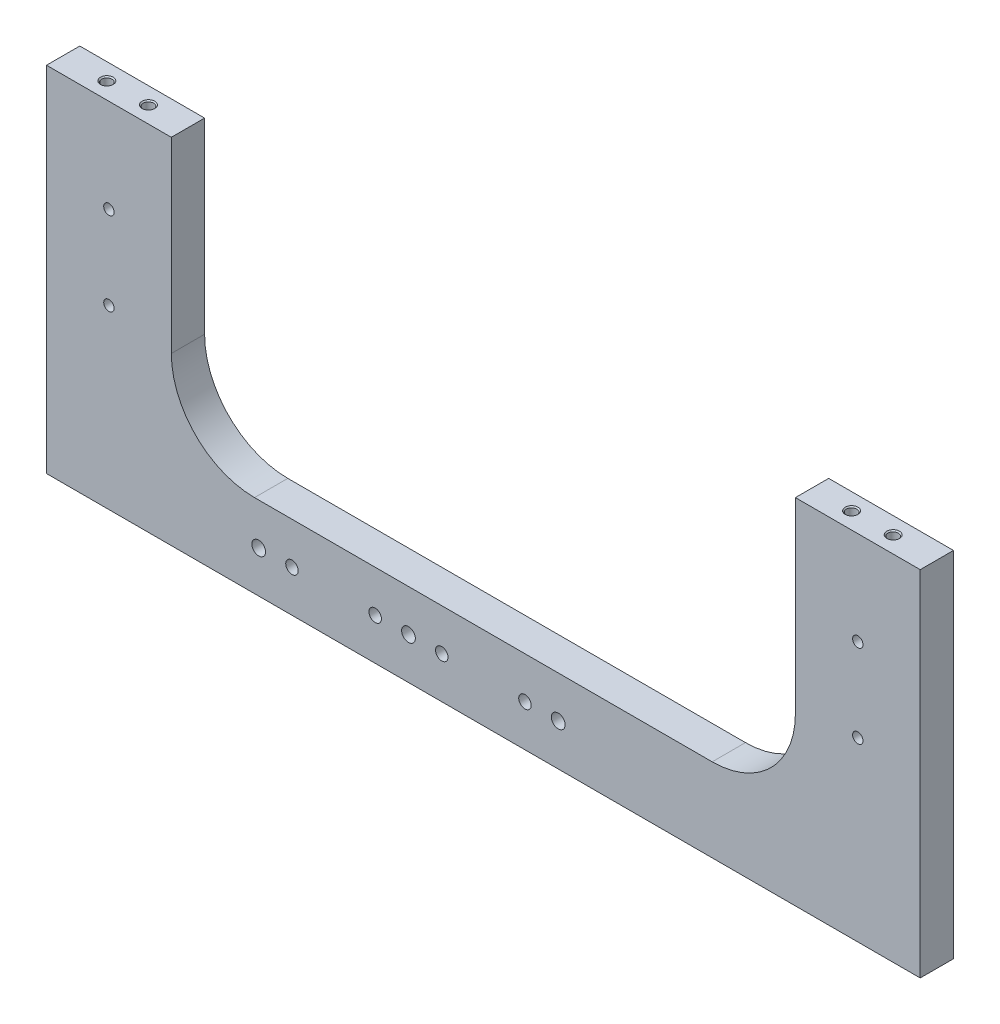
from build123d import *

# Parameters (mm, degrees)
SKIZZE1_W                       = 210
SKIZZE1_H                       = 85
AUFSATZ_LINEAR_AUSTRAGEN1_DEPTH = 8
M3_GEWINDEBOHRUNG1_D            = 2.5
M3_GEWINDEBOHRUNG1_DEPTH        = 8.5
M3_GEWINDEBOHRUNG1_CSINK_D      = 3.05
M3_GEWINDEBOHRUNG1_CSINK_ANGLE  = 90
M3_GEWINDEBOHRUNG1_TIP          = 0.751075774
SKIZZE4_W                       = 150
SKIZZE4_H                       = 65
SCHNITT_LINEAR_AUSTRAGEN1_DEPTH = 8
VERRUNDUNG1_R                   = 20
F_3_0_3_DURCHMESSER_BOHRUNG1_D  = 3
M4_GEWINDEBOHRUNG1_D            = 3.3
LINEARES_MUSTER1_COUNT          = 2
LINEARES_MUSTER1_PITCH          = 36
M3_GEWINDEBOHRUNG2_D            = 2.5
M3_GEWINDEBOHRUNG2_DEPTH        = 8.5
M3_GEWINDEBOHRUNG2_TIP          = 0.751075774


with BuildPart() as part:
    # Skizze1 → Aufsatz-Linear austragen1 (new body)
    with BuildSketch(Plane.XY):
        Rectangle(SKIZZE1_W, SKIZZE1_H)
    extrude(amount=AUFSATZ_LINEAR_AUSTRAGEN1_DEPTH)

    # M3 Gewindebohrung1
    with Locations(Plane(origin=(0, 42.5, 0), x_dir=(1, 0, 0), z_dir=(0, 1, 0))):
        with Locations((-94.5, -4), (-84.5, -4), (84.5, -4), (94.5, -4)):
            CounterSinkHole(M3_GEWINDEBOHRUNG1_D / 2, M3_GEWINDEBOHRUNG1_CSINK_D / 2, depth=M3_GEWINDEBOHRUNG1_DEPTH, counter_sink_angle=M3_GEWINDEBOHRUNG1_CSINK_ANGLE)
            with Locations((0, 0, -(M3_GEWINDEBOHRUNG1_DEPTH + M3_GEWINDEBOHRUNG1_TIP / 2))):  # 118° drill point
                Cone(0, M3_GEWINDEBOHRUNG1_D / 2, M3_GEWINDEBOHRUNG1_TIP, mode=Mode.SUBTRACT)

    # Skizze4 → Schnitt-Linear austragen1 (cut)
    with BuildSketch(Plane.XY.offset(8)):
        with Locations((0, 10)):
            Rectangle(SKIZZE4_W, SKIZZE4_H)
    extrude(amount=-SCHNITT_LINEAR_AUSTRAGEN1_DEPTH, mode=Mode.SUBTRACT)

    # Verrundung1
    verrundung1_edges = [part.edges().sort_by_distance(p)[0] for p in [
        (-75, -22.5, 4),
        (75, -22.5, 4),
    ]]
    fillet(verrundung1_edges, radius=VERRUNDUNG1_R)

    # Ø3.0 (3) Durchmesser Bohrung1 (through all)
    with Locations(Plane.XY.offset(8)):
        with Locations((-10, -32.5), (10, -32.5)):
            f_3_0_3_durchmesser_bohrung1 = Hole(F_3_0_3_DURCHMESSER_BOHRUNG1_D / 2)

    # M4 Gewindebohrung1 (through all)
    with Locations(Plane.XY.offset(8)):
        with Locations((-18, -32.5), (18, -32.5)):
            m4_gewindebohrung1 = Hole(M4_GEWINDEBOHRUNG1_D / 2)

    # Lineares Muster1: Ø3.0 (3) Durchmesser Bohrung1, M4 Gewindebohrung1 ×2
    with Locations(*[(-i * LINEARES_MUSTER1_PITCH, 0, 0) for i in range(1, LINEARES_MUSTER1_COUNT)]):
        add(f_3_0_3_durchmesser_bohrung1, mode=Mode.SUBTRACT)
        add(m4_gewindebohrung1, mode=Mode.SUBTRACT)

    # M3 Gewindebohrung2
    with Locations(Plane.XY.offset(8)):
        with Locations((-90, 20), (-90, 0), (90, 0), (90, 20)):
            Hole(M3_GEWINDEBOHRUNG2_D / 2, depth=M3_GEWINDEBOHRUNG2_DEPTH)
            with Locations((0, 0, -(M3_GEWINDEBOHRUNG2_DEPTH + M3_GEWINDEBOHRUNG2_TIP / 2))):  # 118° drill point
                Cone(0, M3_GEWINDEBOHRUNG2_D / 2, M3_GEWINDEBOHRUNG2_TIP, mode=Mode.SUBTRACT)


solid = part.part
